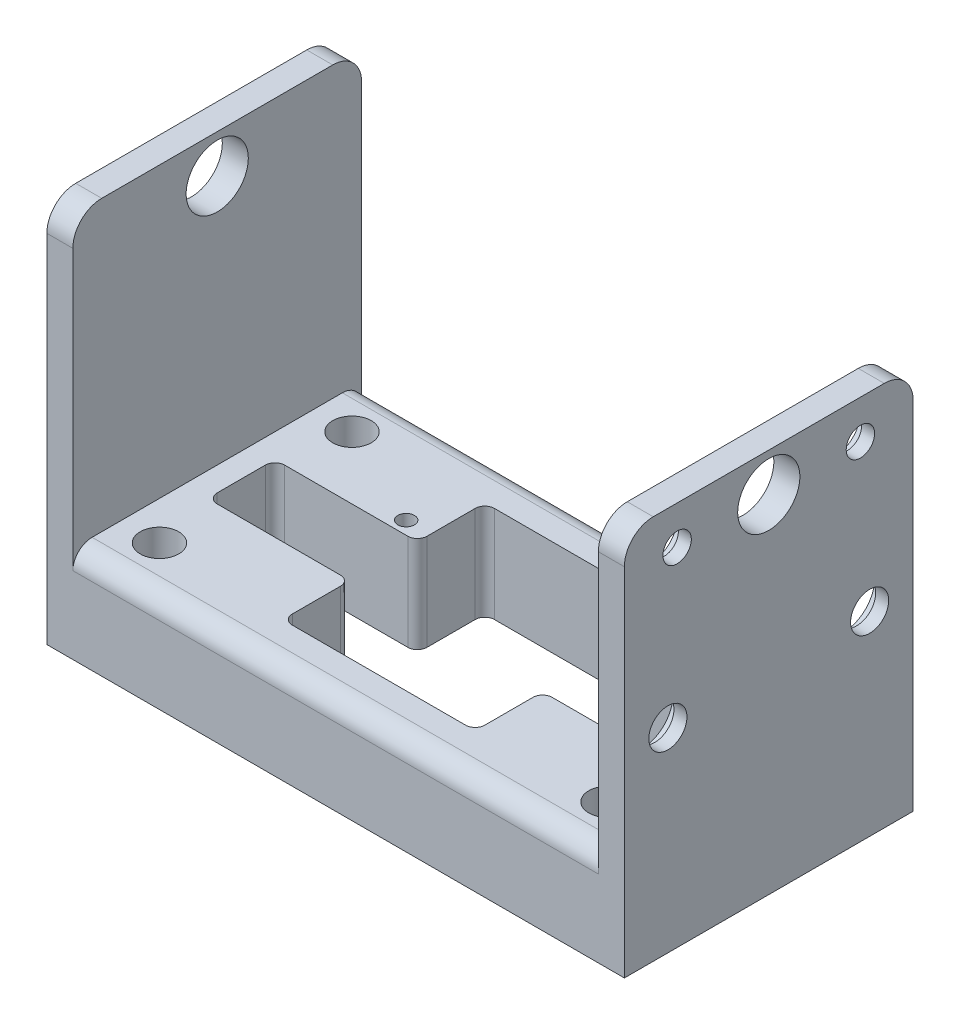
from build123d import *

# Parameters (mm, degrees)
SKETCH1_W            = 60
SKETCH1_H            = 30
BOSS_EXTRUDE1_DEPTH  = 10
SKETCH2_W            = 2.7
SKETCH2_H            = 30
BOSS_EXTRUDE2_DEPTH  = 30
CUT_EXTRUDE1_REACH   = 73.472
SKETCH3_R            = 3.23
FILLET1_R            = 3
FILLET1_OF_MIRROR1_R = 3
FILLET4_R            = 2
CUT_EXTRUDE3_REACH   = 73.472
SKETCH5_R            = 1.98
SKETCH5_R_2          = 1.475
CUT_EXTRUDE4_REACH   = 47
SKETCH6_R            = 0.86
FILLET6_R            = 1
SKETCH7_R            = 2.725
SKETCH7_R_2          = 3.23
CUT_EXTRUDE5_DEPTH   = 1.35
SKETCH8_R            = 2
CUT_EXTRUDE6_DEPTH   = 3
CUT_EXTRUDE7_REACH   = 47
SKETCH9_R            = 1


with BuildPart() as part:
    # Sketch1 → Boss-Extrude1 (new body)
    with BuildSketch(Plane(origin=(0, 0, 0), x_dir=(1, 0, 0), z_dir=(0, 1, 0))):
        Rectangle(SKETCH1_W, SKETCH1_H)
    extrude(amount=BOSS_EXTRUDE1_DEPTH)

    # Sketch2 → Boss-Extrude2 (add)
    with BuildSketch(Plane(origin=(0, 10, 0), x_dir=(1, 0, 0), z_dir=(0, 1, 0))):
        with Locations((-28.65, 0)):
            Rectangle(SKETCH2_W, SKETCH2_H)
    boss_extrude2 = extrude(amount=BOSS_EXTRUDE2_DEPTH)

    # Sketch3 → Cut-Extrude1 (cut, up to next)
    with BuildSketch(Plane(origin=(-27.3, 0, 0), x_dir=(0, 0, -1), z_dir=(1, 0, 0)), mode=Mode.PRIVATE) as cut_extrude1_sk1:
        with Locations((0, 36)):
            Circle(SKETCH3_R)
    cut_extrude1_tool1 = extrude(cut_extrude1_sk1.sketch, amount=-CUT_EXTRUDE1_REACH, mode=Mode.PRIVATE) & part.part
    cut_extrude1 = cut_extrude1_tool1.solids().sort_by_distance((-27.3, 36, 0))[0]
    add(cut_extrude1, mode=Mode.SUBTRACT)

    # Fillet1
    fillet1_edges = [part.edges().sort_by_distance(p)[0] for p in [
        (-28.65, 40, 15),
        (-28.65, 40, -15),
    ]]
    fillet(fillet1_edges, radius=FILLET1_R)

    # Mirror1: Boss-Extrude2, Cut-Extrude1 across plane
    add(boss_extrude2.mirror(Plane(origin=(0, 0, 0), x_dir=(0, 0, 1), z_dir=(1, 0, 0))))
    add(cut_extrude1.mirror(Plane(origin=(0, 0, 0), x_dir=(0, 0, 1), z_dir=(1, 0, 0))), mode=Mode.SUBTRACT)

    # Fillet1 of Mirror1
    fillet1_of_mirror1_edges = [part.edges().sort_by_distance(p)[0] for p in [
        (28.65, 40, 15),
        (28.65, 40, -15),
    ]]
    fillet(fillet1_of_mirror1_edges, radius=FILLET1_OF_MIRROR1_R)

    # Fillet4
    fillet4_edges = [part.edges().sort_by_distance(p)[0] for p in [
        (0, 10, 15),
        (0, 10, -15),
    ]]
    fillet(fillet4_edges, radius=FILLET4_R)

    # Sketch5 → Cut-Extrude3 (cut, up to next)
    with BuildSketch(Plane.ZY.offset(-27.3), mode=Mode.PRIVATE) as cut_extrude3_sk1:
        with Locations((10.48, 20.25)):
            Circle(SKETCH5_R)
    cut_extrude3_tool1 = extrude(cut_extrude3_sk1.sketch, amount=-CUT_EXTRUDE3_REACH, mode=Mode.PRIVATE) & part.part
    # Sketch5 → Cut-Extrude3 (cut, up to next)
    with BuildSketch(Plane.ZY.offset(-27.3), mode=Mode.PRIVATE) as cut_extrude3_sk2:
        with Locations((9.52, 36)):
            Circle(SKETCH5_R_2)
    cut_extrude3_tool2 = extrude(cut_extrude3_sk2.sketch, amount=-CUT_EXTRUDE3_REACH, mode=Mode.PRIVATE) & part.part
    cut_extrude3_1 = cut_extrude3_tool1.solids().sort_by_distance((27.3, 20.25, 10.48))[0]
    add(cut_extrude3_1, mode=Mode.SUBTRACT)
    cut_extrude3_2 = cut_extrude3_tool2.solids().sort_by_distance((27.3, 36, 9.52))[0]
    add(cut_extrude3_2, mode=Mode.SUBTRACT)
    cut_extrude3 = cut_extrude3_1 + cut_extrude3_2  # Cut-Extrude3 as one shape, for the pattern or mirror that repeats it

    # Mirror2: Cut-Extrude3 across plane
    add(cut_extrude3.mirror(Plane.XY), mode=Mode.SUBTRACT)

    # Sketch6 → Cut-Extrude4 (cut, up to next)
    with BuildSketch(Plane(origin=(0, 10, 0), x_dir=(1, 0, 0), z_dir=(0, 1, 0)), mode=Mode.PRIVATE) as cut_extrude4_sk1:
        with Locations(Location((-12.53, 4.86, 0), (0, 0, 270))):
            Circle(SKETCH6_R)
    cut_extrude4_tool1 = extrude(cut_extrude4_sk1.sketch, amount=-CUT_EXTRUDE4_REACH, mode=Mode.PRIVATE) & part.part
    # Sketch6 → Cut-Extrude4 (cut, up to next)
    with BuildSketch(Plane(origin=(0, 10, 0), x_dir=(1, 0, 0), z_dir=(0, 1, 0)), mode=Mode.PRIVATE) as cut_extrude4_sk2:
        Polygon((-24.8, -3.5), (-24.8, 3.5), (-10, 3.5), (-10, 10.5), (10, 10.5), (10, 3.5), (24.8, 3.5), (24.8, -3.5), (10, -3.5), (10, -10.5), (-10, -10.5), (-10, -3.5), align=None)
    cut_extrude4_tool2 = extrude(cut_extrude4_sk2.sketch, amount=-CUT_EXTRUDE4_REACH, mode=Mode.PRIVATE) & part.part
    add(cut_extrude4_tool1.solids().sort_by_distance((-12.53, 10, -4.86))[0], mode=Mode.SUBTRACT)
    add(cut_extrude4_tool2.solids().sort_by_distance((0, 10, 0))[0], mode=Mode.SUBTRACT)

    # Fillet6
    fillet6_edges = [part.edges().sort_by_distance(p)[0] for p in [
        (-24.8, 5, -3.5),
        (-10, 5, -3.5),
        (-10, 5, -10.5),
        (10, 5, -10.5),
        (10, 5, -3.5),
        (24.8, 5, -3.5),
        (24.8, 5, 3.5),
        (10, 5, 3.5),
        (10, 5, 10.5),
        (-10, 5, 10.5),
        (-10, 5, 3.5),
        (-24.8, 5, 3.5),
    ]]
    fillet(fillet6_edges, radius=FILLET6_R)

    # Sketch7 → Cut-Extrude5 (cut)
    with BuildSketch(Plane.ZY.offset(-27.3)):
        with Locations((-9.52, 36)):
            Circle(SKETCH7_R)
        with Locations((-10.48, 20.25)):
            Circle(SKETCH7_R_2)
        with Locations((10.48, 20.25)):
            Circle(SKETCH7_R_2)
        with Locations((9.52, 36)):
            Circle(SKETCH7_R)
    extrude(amount=-CUT_EXTRUDE5_DEPTH, mode=Mode.SUBTRACT)

    # Sketch8 → Cut-Extrude6 (cut)
    with BuildSketch(Plane(origin=(0, 10, 0), x_dir=(1, 0, 0), z_dir=(0, 1, 0))):
        with Locations(Location((-23.3, 10, 0), (0, 0, 270))):
            Circle(SKETCH8_R)
        with Locations(Location((-23.3, -10, 0), (0, 0, 270))):
            Circle(SKETCH8_R)
    cut_extrude6 = extrude(amount=-CUT_EXTRUDE6_DEPTH, mode=Mode.SUBTRACT)

    # Sketch9 → Cut-Extrude7 (cut, up to next)
    with BuildSketch(Plane(origin=(0, 10, 0), x_dir=(1, 0, 0), z_dir=(0, 1, 0)), mode=Mode.PRIVATE) as cut_extrude7_sk1:
        with Locations(Location((-23.3, 10, 0), (0, 0, 270))):
            Circle(SKETCH9_R)
    cut_extrude7_tool1 = extrude(cut_extrude7_sk1.sketch, amount=-CUT_EXTRUDE7_REACH, mode=Mode.PRIVATE) & part.part
    # Sketch9 → Cut-Extrude7 (cut, up to next)
    with BuildSketch(Plane(origin=(0, 10, 0), x_dir=(1, 0, 0), z_dir=(0, 1, 0)), mode=Mode.PRIVATE) as cut_extrude7_sk2:
        with Locations(Location((-23.3, -10, 0), (0, 0, 270))):
            Circle(SKETCH9_R)
    cut_extrude7_tool2 = extrude(cut_extrude7_sk2.sketch, amount=-CUT_EXTRUDE7_REACH, mode=Mode.PRIVATE) & part.part
    cut_extrude7_1 = cut_extrude7_tool1.solids().sort_by_distance((-23.3, 10, -10))[0]
    add(cut_extrude7_1, mode=Mode.SUBTRACT)
    cut_extrude7_2 = cut_extrude7_tool2.solids().sort_by_distance((-23.3, 10, 10))[0]
    add(cut_extrude7_2, mode=Mode.SUBTRACT)
    cut_extrude7 = cut_extrude7_1 + cut_extrude7_2  # Cut-Extrude7 as one shape, for the pattern or mirror that repeats it

    # Mirror3: Cut-Extrude6, Cut-Extrude7 across plane
    add(cut_extrude6.mirror(Plane(origin=(0, 0, 0), x_dir=(0, 0, 1), z_dir=(1, 0, 0))), mode=Mode.SUBTRACT)
    add(cut_extrude7.mirror(Plane(origin=(0, 0, 0), x_dir=(0, 0, 1), z_dir=(1, 0, 0))), mode=Mode.SUBTRACT)


solid = part.part
